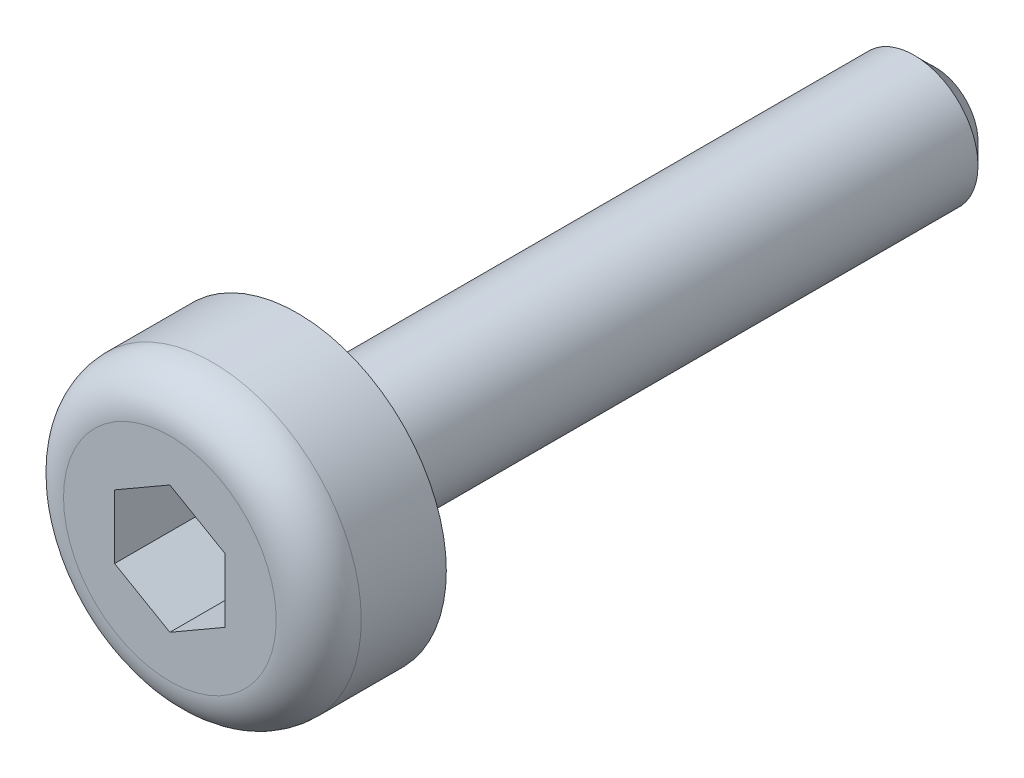
from build123d import *

# Parameters (mm, degrees)
FOOTPRINT_DEPTH = 2.5
CHAMFER1_SIZE   = 0.5
FILLET1_R       = 1


with BuildPart() as part:
    # Sketch1 → Body (revolve)
    with BuildSketch(Plane(origin=(0, 0, 0), x_dir=(0, 0, -1), z_dir=(1, 0, 0)), mode=Mode.PRIVATE) as body_sk:
        Polygon((0, 0), (0, 3.5), (3, 3.5), (3, 1.5), (18, 1.5), (18, 0), align=None)
    revolve(body_sk.sketch.rotate(Axis((0, 0, 156.291575099), (0, 0, -1)), 90), axis=Axis((0, 0, 156.291575099), (0, 0, -1)))

    # Sketch2 → Footprint (cut)
    with BuildSketch(Plane.XY):
        Polygon((0, 1.5), (-1.299038106, 0.75), (-1.299038106, -0.75), (0, -1.5), (1.299038106, -0.75), (1.299038106, 0.75), align=None)
    extrude(amount=-FOOTPRINT_DEPTH, mode=Mode.SUBTRACT)

    # Chamfer1
    chamfer1_edges = [part.edges().sort_by_distance(p)[0] for p in [
        (-1.5, 0, -18),
    ]]
    chamfer(chamfer1_edges, length=CHAMFER1_SIZE)

    # Fillet1
    fillet1_edges = [part.edges().sort_by_distance(p)[0] for p in [
        (-3.5, 0, 0),
    ]]
    fillet(fillet1_edges, radius=FILLET1_R)


solid = part.part
